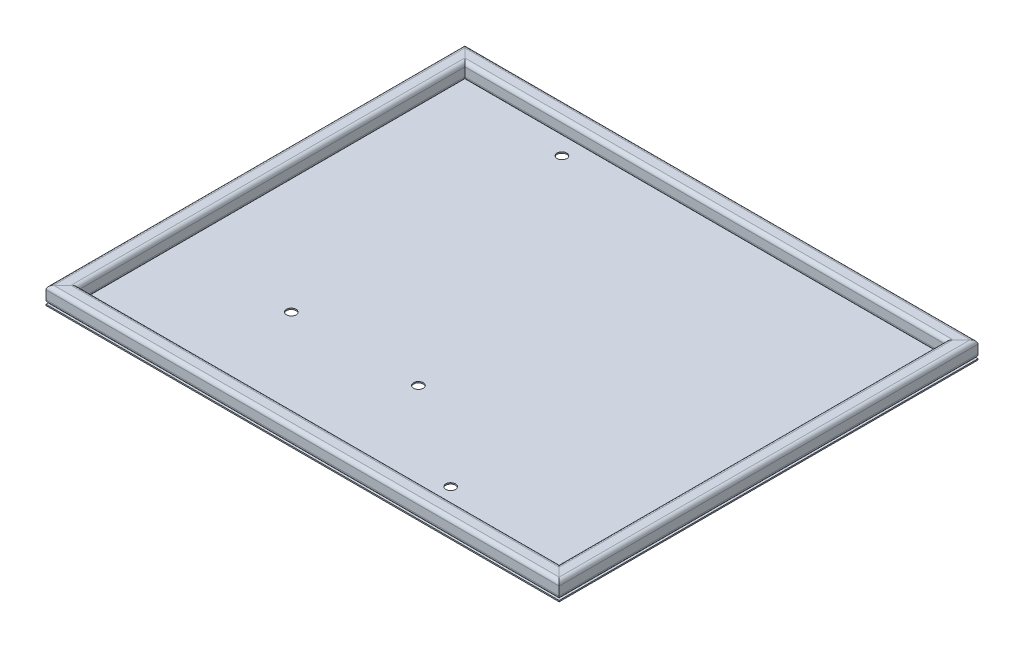
from build123d import *

# Parameters (mm, degrees)
TUBO_CUADRADO_2_X_2_X_0_25_1_DEPTH      = 686.921024484
TUBO_CUADRADO_2_X_2_X_0_25_1_DEPTH_BACK = 36.921024484
TUBO_CUADRADO_2_X_2_X_0_25_1_2_DEPTH    = 870.242048969
TUBO_CUADRADO_2_X_2_X_0_25_1_3_DEPTH    = 723.842048969
TUBO_CUADRADO_2_X_2_X_0_25_1_4_DEPTH    = 870.242048969
CROQUIS3_W                              = 796.4
CROQUIS3_H                              = 650
SALIENTE_EXTRUIR1_DEPTH                 = 1.9
CROQUIS7_R                              = 7.5
CORTAR_EXTRUIR1_DEPTH                   = 10


with BuildPart() as part:
    # Sketch1 → Tubo cuadrado 2 X 2 X 0.25(1) (new, two sides: drawn at the far end of the back side and taken through both)
    with BuildSketch(Plane(origin=(-385.5, 12.7, -325), x_dir=(1, 0, 0), z_dir=(0, 0, 1)).offset(-TUBO_CUADRADO_2_X_2_X_0_25_1_DEPTH_BACK)):
        with BuildLine():
            Line((-6.7, -12.7), (6.7, -12.7))
            ThreePointArc((6.7, -12.7), (10.942640687, -10.942640687), (12.7, -6.7))
            Line((12.7, -6.7), (12.7, 6.7))
            ThreePointArc((12.7, 6.7), (10.942640687, 10.942640687), (6.7, 12.7))
            Line((6.7, 12.7), (-6.7, 12.7))
            ThreePointArc((-6.7, 12.7), (-10.942640687, 10.942640687), (-12.7, 6.7))
            Line((-12.7, 6.7), (-12.7, -6.7))
            ThreePointArc((-12.7, -6.7), (-10.942640687, -10.942640687), (-6.7, -12.7))
        make_face()
        with BuildLine():
            Line((-6.7, -9.7), (6.7, -9.7))
            ThreePointArc((6.7, -9.7), (8.821320344, -8.821320344), (9.7, -6.7))
            Line((9.7, -6.7), (9.7, 6.7))
            ThreePointArc((9.7, 6.7), (8.821320344, 8.821320344), (6.7, 9.7))
            Line((6.7, 9.7), (-6.7, 9.7))
            ThreePointArc((-6.7, 9.7), (-8.821320344, 8.821320344), (-9.7, 6.7))
            Line((-9.7, 6.7), (-9.7, -6.7))
            ThreePointArc((-9.7, -6.7), (-8.821320344, -8.821320344), (-6.7, -9.7))
        make_face(mode=Mode.SUBTRACT)
    extrude(amount=TUBO_CUADRADO_2_X_2_X_0_25_1_DEPTH + TUBO_CUADRADO_2_X_2_X_0_25_1_DEPTH_BACK)

    # Tubo cuadrado 2 X 2 X 0.25(1) mitre 1
    split(bisect_by=Plane(origin=(-398.2, 0, -325), x_dir=(0, -1, 0), z_dir=(-0.707106781, 0, 0.707106781)), keep=Keep.TOP)

    # Tubo cuadrado 2 X 2 X 0.25(1) mitre 2
    split(bisect_by=Plane(origin=(-398.2, 0, 325), x_dir=(0, -1, 0), z_dir=(-0.707106781, 0, -0.707106781)), keep=Keep.TOP)


with BuildPart() as body_2:
    # Sketch1 on segment 2 (carried to segment 2) → Tubo cuadrado 2 X 2 X 0.25_1 2 (new body)
    with BuildSketch(Plane(origin=(-435.121024484, 12.7, 312.3), x_dir=(0, 0, -1), z_dir=(1, 0, 0))):
        with BuildLine():
            Line((-6.7, -12.7), (6.7, -12.7))
            ThreePointArc((6.7, -12.7), (10.942640687, -10.942640687), (12.7, -6.7))
            Line((12.7, -6.7), (12.7, 6.7))
            ThreePointArc((12.7, 6.7), (10.942640687, 10.942640687), (6.7, 12.7))
            Line((6.7, 12.7), (-6.7, 12.7))
            ThreePointArc((-6.7, 12.7), (-10.942640687, 10.942640687), (-12.7, 6.7))
            Line((-12.7, 6.7), (-12.7, -6.7))
            ThreePointArc((-12.7, -6.7), (-10.942640687, -10.942640687), (-6.7, -12.7))
        make_face()
        with BuildLine():
            Line((-6.7, -9.7), (6.7, -9.7))
            ThreePointArc((6.7, -9.7), (8.821320344, -8.821320344), (9.7, -6.7))
            Line((9.7, -6.7), (9.7, 6.7))
            ThreePointArc((9.7, 6.7), (8.821320344, 8.821320344), (6.7, 9.7))
            Line((6.7, 9.7), (-6.7, 9.7))
            ThreePointArc((-6.7, 9.7), (-8.821320344, 8.821320344), (-9.7, 6.7))
            Line((-9.7, 6.7), (-9.7, -6.7))
            ThreePointArc((-9.7, -6.7), (-8.821320344, -8.821320344), (-6.7, -9.7))
        make_face(mode=Mode.SUBTRACT)
    extrude(amount=TUBO_CUADRADO_2_X_2_X_0_25_1_2_DEPTH)

    # Tubo cuadrado 2 X 2 X 0.25_1 2 mitre 1
    split(bisect_by=Plane(origin=(-398.2, 0, 325), x_dir=(0, 1, 0), z_dir=(0.707106781, 0, 0.707106781)), keep=Keep.TOP)

    # Tubo cuadrado 2 X 2 X 0.25_1 2 mitre 2
    split(bisect_by=Plane(origin=(398.2, 0, 325), x_dir=(0, -1, 0), z_dir=(-0.707106781, 0, 0.707106781)), keep=Keep.TOP)


with BuildPart() as body_3:
    # Sketch1 on segment 3 (carried to segment 3) → Tubo cuadrado 2 X 2 X 0.25_1 3 (new body)
    with BuildSketch(Plane(origin=(385.5, 12.7, 361.921024484), x_dir=(-1, 0, 0), z_dir=(0, 0, -1))):
        with BuildLine():
            Line((-6.7, -12.7), (6.7, -12.7))
            ThreePointArc((6.7, -12.7), (10.942640687, -10.942640687), (12.7, -6.7))
            Line((12.7, -6.7), (12.7, 6.7))
            ThreePointArc((12.7, 6.7), (10.942640687, 10.942640687), (6.7, 12.7))
            Line((6.7, 12.7), (-6.7, 12.7))
            ThreePointArc((-6.7, 12.7), (-10.942640687, 10.942640687), (-12.7, 6.7))
            Line((-12.7, 6.7), (-12.7, -6.7))
            ThreePointArc((-12.7, -6.7), (-10.942640687, -10.942640687), (-6.7, -12.7))
        make_face()
        with BuildLine():
            Line((-6.7, -9.7), (6.7, -9.7))
            ThreePointArc((6.7, -9.7), (8.821320344, -8.821320344), (9.7, -6.7))
            Line((9.7, -6.7), (9.7, 6.7))
            ThreePointArc((9.7, 6.7), (8.821320344, 8.821320344), (6.7, 9.7))
            Line((6.7, 9.7), (-6.7, 9.7))
            ThreePointArc((-6.7, 9.7), (-8.821320344, 8.821320344), (-9.7, 6.7))
            Line((-9.7, 6.7), (-9.7, -6.7))
            ThreePointArc((-9.7, -6.7), (-8.821320344, -8.821320344), (-6.7, -9.7))
        make_face(mode=Mode.SUBTRACT)
    extrude(amount=TUBO_CUADRADO_2_X_2_X_0_25_1_3_DEPTH)

    # Tubo cuadrado 2 X 2 X 0.25_1 3 mitre 1
    split(bisect_by=Plane(origin=(398.2, 0, -325), x_dir=(0, 1, 0), z_dir=(0.707106781, 0, 0.707106781)), keep=Keep.TOP)

    # Tubo cuadrado 2 X 2 X 0.25_1 3 mitre 2
    split(bisect_by=Plane(origin=(398.2, 0, 325), x_dir=(0, 1, 0), z_dir=(0.707106781, 0, -0.707106781)), keep=Keep.TOP)


with BuildPart() as body_4:
    # Sketch1 on segment 4 (carried to segment 4) → Tubo cuadrado 2 X 2 X 0.25_1 4 (new body)
    with BuildSketch(Plane(origin=(435.121024484, 12.7, -312.3), x_dir=(0, 0, 1), z_dir=(-1, 0, 0))):
        with BuildLine():
            Line((-6.7, -12.7), (6.7, -12.7))
            ThreePointArc((6.7, -12.7), (10.942640687, -10.942640687), (12.7, -6.7))
            Line((12.7, -6.7), (12.7, 6.7))
            ThreePointArc((12.7, 6.7), (10.942640687, 10.942640687), (6.7, 12.7))
            Line((6.7, 12.7), (-6.7, 12.7))
            ThreePointArc((-6.7, 12.7), (-10.942640687, 10.942640687), (-12.7, 6.7))
            Line((-12.7, 6.7), (-12.7, -6.7))
            ThreePointArc((-12.7, -6.7), (-10.942640687, -10.942640687), (-6.7, -12.7))
        make_face()
        with BuildLine():
            Line((-6.7, -9.7), (6.7, -9.7))
            ThreePointArc((6.7, -9.7), (8.821320344, -8.821320344), (9.7, -6.7))
            Line((9.7, -6.7), (9.7, 6.7))
            ThreePointArc((9.7, 6.7), (8.821320344, 8.821320344), (6.7, 9.7))
            Line((6.7, 9.7), (-6.7, 9.7))
            ThreePointArc((-6.7, 9.7), (-8.821320344, 8.821320344), (-9.7, 6.7))
            Line((-9.7, 6.7), (-9.7, -6.7))
            ThreePointArc((-9.7, -6.7), (-8.821320344, -8.821320344), (-6.7, -9.7))
        make_face(mode=Mode.SUBTRACT)
    extrude(amount=TUBO_CUADRADO_2_X_2_X_0_25_1_4_DEPTH)

    # Tubo cuadrado 2 X 2 X 0.25_1 4 mitre 1
    split(bisect_by=Plane(origin=(-398.2, 0, -325), x_dir=(0, 1, 0), z_dir=(0.707106781, 0, -0.707106781)), keep=Keep.TOP)

    # Tubo cuadrado 2 X 2 X 0.25_1 4 mitre 2
    split(bisect_by=Plane(origin=(398.2, 0, -325), x_dir=(0, -1, 0), z_dir=(-0.707106781, 0, -0.707106781)), keep=Keep.TOP)


with BuildPart() as body_5:
    # Croquis3 → Saliente-Extruir1 (new body)
    with BuildSketch(Plane.XZ):
        Rectangle(CROQUIS3_W, CROQUIS3_H)
    extrude(amount=SALIENTE_EXTRUIR1_DEPTH)

    # Croquis7 → Cortar-Extruir1 (cut)
    with BuildSketch(Plane.XZ.offset(1.9)):
        with Locations((0, 145.21)):
            Circle(CROQUIS7_R)
        with Locations((161, 256.21)):
            Circle(CROQUIS7_R)
        with Locations((-197.3, 145.21)):
            Circle(CROQUIS7_R)
        with Locations((-197.3, -274.79)):
            Circle(CROQUIS7_R)
    extrude(amount=-CORTAR_EXTRUIR1_DEPTH, mode=Mode.SUBTRACT)


solid = Compound([part.part, body_2.part, body_3.part, body_4.part, body_5.part])
